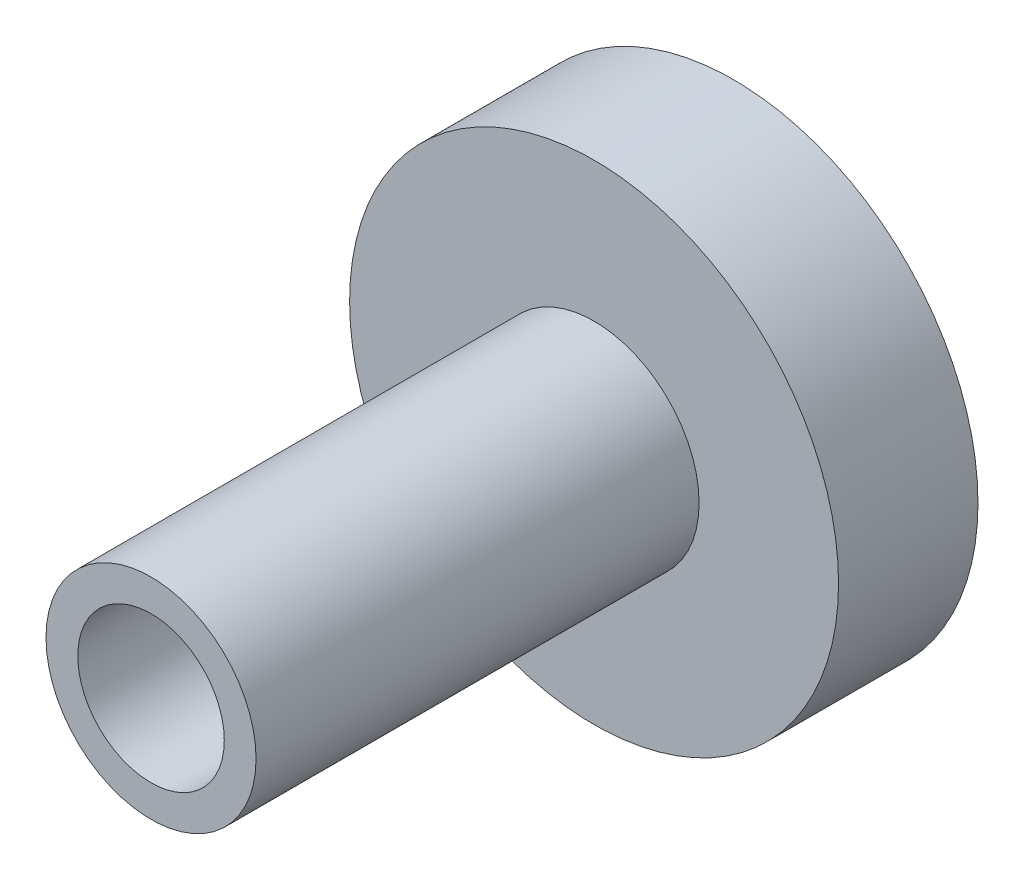
from build123d import *

# Parameters (mm, degrees)
SKETCH1_R           = 13.85
SKETCH1_R_2         = 4.15
BOSS_EXTRUDE1_DEPTH = 33
CUT_EXTRUDE1_START  = -25.1
SKETCH2_R           = 13.85
SKETCH2_R_2         = 5.95
CUT_EXTRUDE1_DEPTH  = 25.1


with BuildPart() as part:
    # Sketch1 → Boss-Extrude1 (new body)
    with BuildSketch(Plane.XY):
        Circle(SKETCH1_R)
        Circle(SKETCH1_R_2, mode=Mode.SUBTRACT)
    extrude(amount=BOSS_EXTRUDE1_DEPTH)

    # Sketch2 → Cut-Extrude1 (cut)
    with BuildSketch(Plane.XY.offset(33).offset(CUT_EXTRUDE1_START)):
        Circle(SKETCH2_R)
        Circle(SKETCH2_R_2, mode=Mode.SUBTRACT)
    extrude(amount=CUT_EXTRUDE1_DEPTH, mode=Mode.SUBTRACT)


solid = part.part
